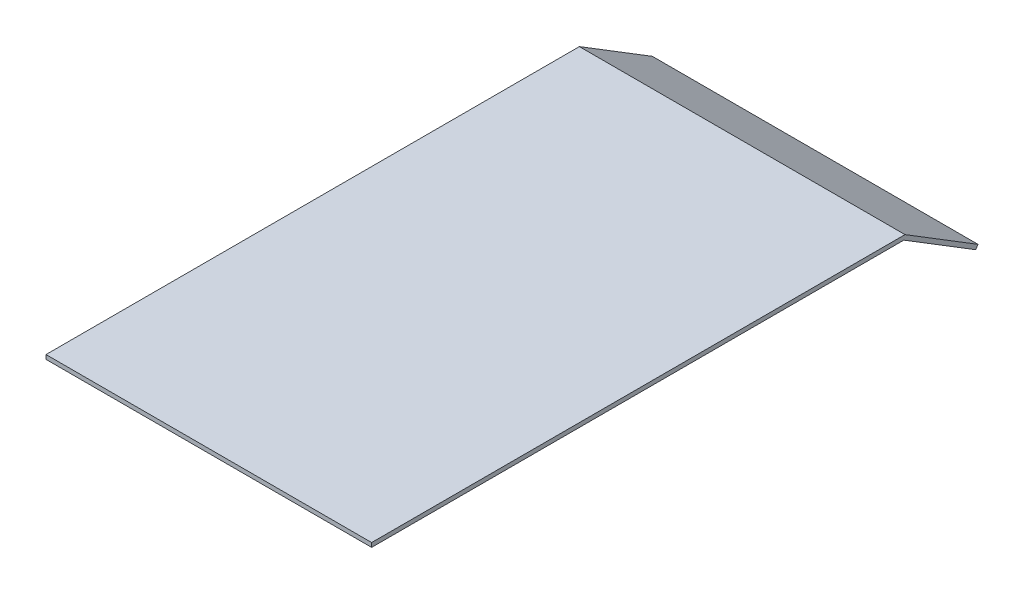
from build123d import *

# Parameters (mm, degrees)
SKETCH1_W           = 232
SKETCH1_H           = 380
BOSS_EXTRUDE1_DEPTH = 3
EXTRUDE_THIN1_DEPTH = 232


with BuildPart() as part:
    # Sketch1 → Boss-Extrude1 (new body)
    with BuildSketch(Plane(origin=(0, 0, 0), x_dir=(1, 0, 0), z_dir=(0, 1, 0))):
        Rectangle(SKETCH1_W, SKETCH1_H)
    extrude(amount=BOSS_EXTRUDE1_DEPTH)

    # Sketch5 → Extrude-Thin1 (add)
    with BuildSketch(Plane(origin=(116, 0, 0), x_dir=(0, 0, -1), z_dir=(1, 0, 0))):
        Polygon((190, 3), (242, -29), (240.427707723, -31.55497495), (188.427707723, 0.44502505), align=None)
    extrude(amount=-EXTRUDE_THIN1_DEPTH)


solid = part.part
